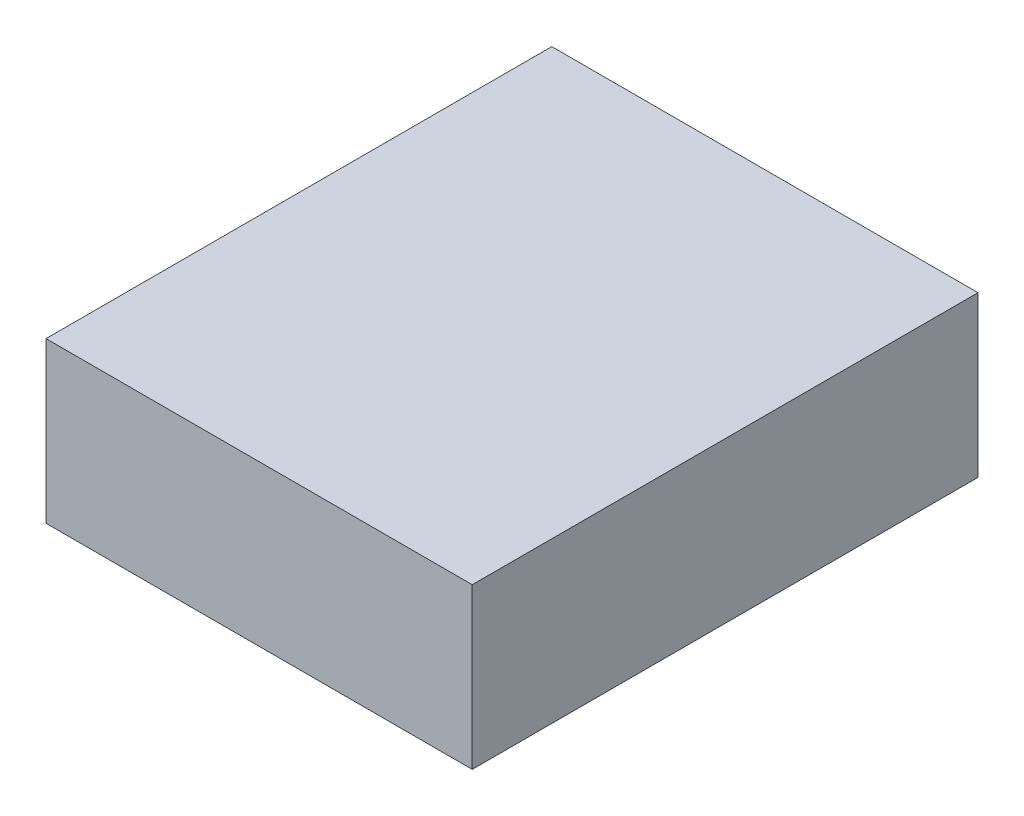
from build123d import *

# Parameters (mm, degrees)
SKETCH1_W             = 26.648053927
SKETCH1_H             = 31.619452056
PIERCEABLEPLANE_DEPTH = 10


with BuildPart() as part:
    # Sketch1 → pierceablePlane (new body)
    with BuildSketch(Plane(origin=(0, 0, 0), x_dir=(1, 0, 0), z_dir=(0, 1, 0))):
        with Locations((2.846202936, 0.590770954)):
            Rectangle(SKETCH1_W, SKETCH1_H)
    extrude(amount=-PIERCEABLEPLANE_DEPTH)


solid = part.part
